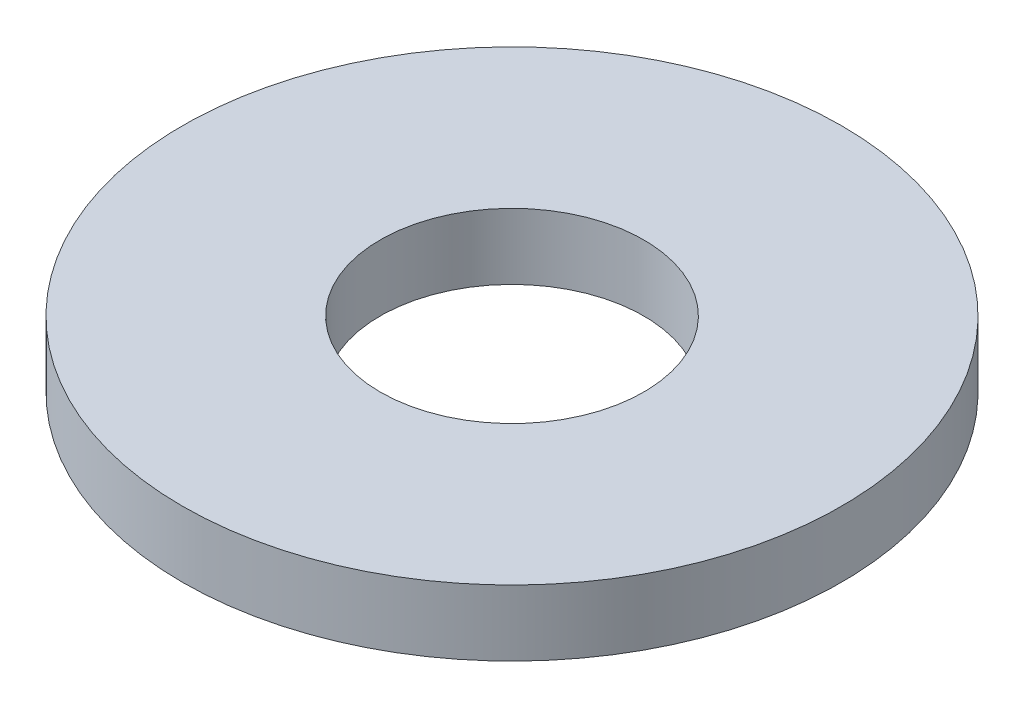
from build123d import *

# Parameters (mm, degrees)
SKETCH1_R           = 5
SKETCH1_R_2         = 2
BOSS_EXTRUDE1_DEPTH = 1


with BuildPart() as part:
    # Sketch1 → Boss-Extrude1 (new body)
    with BuildSketch(Plane(origin=(0, 0, 0), x_dir=(1, 0, 0), z_dir=(0, 1, 0))):
        with Locations(Location((0, 0, 0), (0, 0, 270))):
            Circle(SKETCH1_R)
        with Locations(Location((0, 0, 0), (0, 0, 270))):
            Circle(SKETCH1_R_2, mode=Mode.SUBTRACT)
    extrude(amount=BOSS_EXTRUDE1_DEPTH)


solid = part.part
